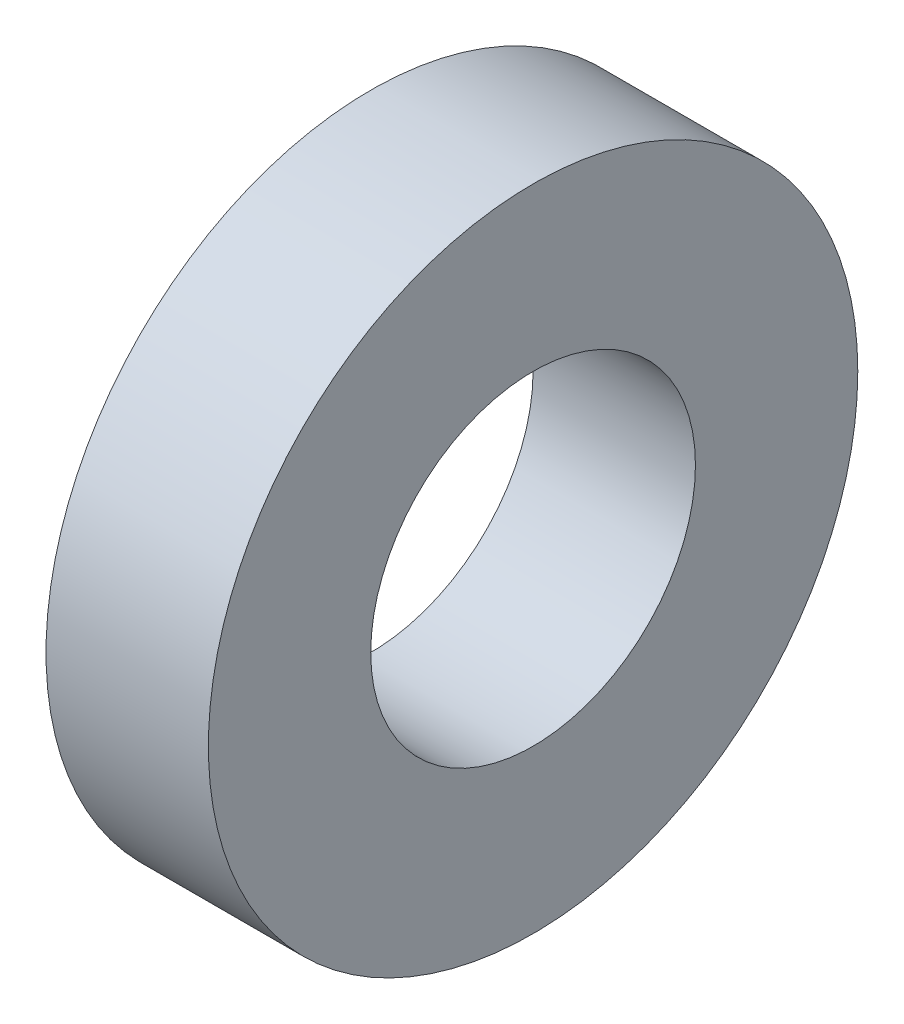
from build123d import *

# Parameters (mm, degrees)
SKETCH1_R           = 20
SKETCH1_R_2         = 10
BOSS_EXTRUDE1_DEPTH = 10


with BuildPart() as part:
    # Sketch1 → Boss-Extrude1 (new body)
    with BuildSketch(Plane(origin=(0, 0, 0), x_dir=(0, 0, -1), z_dir=(1, 0, 0))):
        Circle(SKETCH1_R)
        Circle(SKETCH1_R_2, mode=Mode.SUBTRACT)
    extrude(amount=BOSS_EXTRUDE1_DEPTH)


solid = part.part
